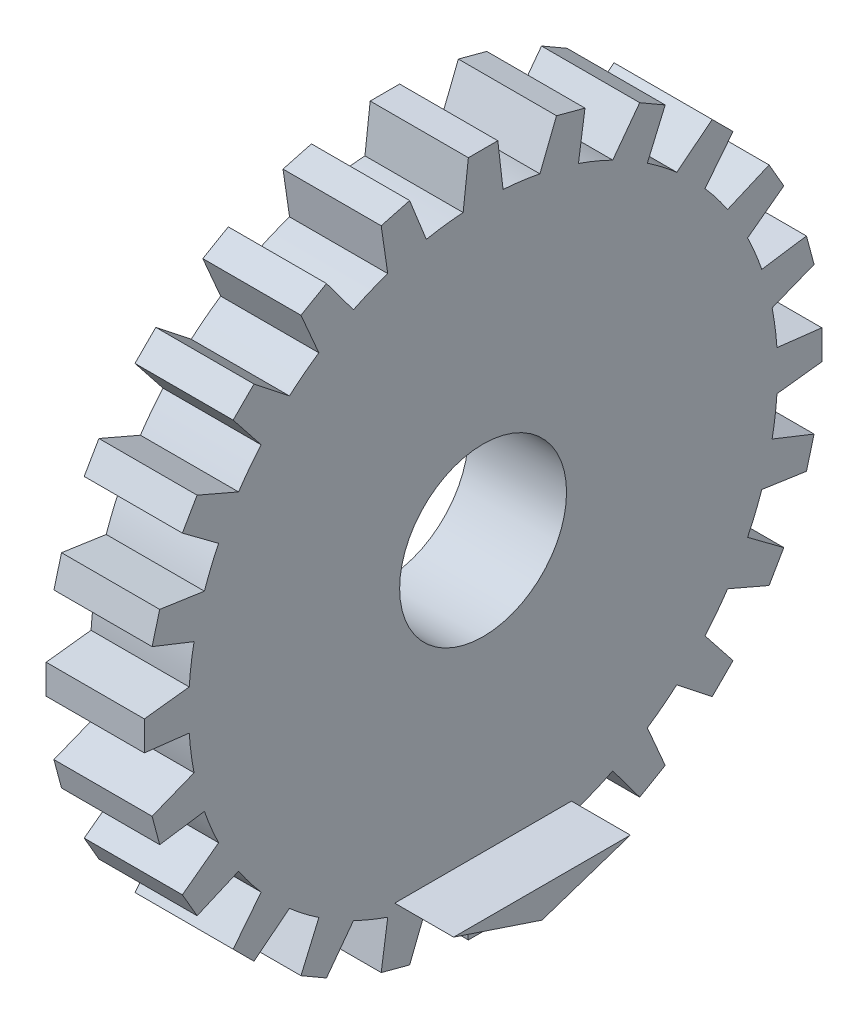
from build123d import *

# Parameters (mm, degrees)
SKETCH2_R           = 5
BOSS_EXTRUDE1_DEPTH = 100
SKETCH8_R           = 5
BOSS_EXTRUDE3_DEPTH = 10
SKETCH9_R           = 5
BOSS_EXTRUDE4_DEPTH = 100
BOSS_EXTRUDE5_START = 100
SKETCH4_R           = 5
BOSS_EXTRUDE5_DEPTH = 100
SKETCH17_R          = 8.5
CUT_EXTRUDE1_DEPTH  = 305
BOSS_EXTRUDE8_DEPTH = 6


with BuildPart() as part:
    # Sketch2 → Boss-Extrude1 (new body)
    with BuildSketch(Plane(origin=(0, 0, 0), x_dir=(0, 0, -1), z_dir=(1, 0, 0))):
        Circle(SKETCH2_R)
    extrude(amount=BOSS_EXTRUDE1_DEPTH)

    # Sketch8 → Boss-Extrude3 (add)
    with BuildSketch(Plane.ZY):
        with BuildLine():
            ThreePointArc((5.782716145, 29.437394484), (3.915785767, 29.743345841), (2.03328346, 29.931016661))
            Line((2.03328346, 29.931016661), (1.5, 34.5))
            Line((1.5, 34.5), (-1.5, 34.5))
            Line((-1.5, 34.5), (-2.03328346, 29.931016661))
            ThreePointArc((-2.03328346, 29.931016661), (-3.915785767, 29.743345841), (-5.782716145, 29.437394484))
            Line((-5.782716145, 29.437394484), (-7.480368317, 33.712669575))
            Line((-7.480368317, 33.712669575), (-10.378145795, 32.936212439))
            Line((-10.378145795, 32.936212439), (-9.710718158, 28.384889516))
            ThreePointArc((-9.710718158, 28.384889516), (-11.480502971, 27.716385975), (-13.204633201, 26.93766252))
            Line((-13.204633201, 26.93766252), (-15.950961894, 30.627876431))
            Line((-15.950961894, 30.627876431), (-18.549038106, 29.127876431))
            Line((-18.549038106, 29.127876431), (-16.72638346, 24.904379059))
            ThreePointArc((-16.72638346, 24.904379059), (-18.26284287, 23.800600209), (-19.726676326, 22.602173372))
            Line((-19.726676326, 22.602173372), (-23.334523779, 25.455844123))
            Line((-23.334523779, 25.455844123), (-25.455844123, 23.334523779))
            Line((-25.455844123, 23.334523779), (-22.602173372, 19.726676326))
            ThreePointArc((-22.602173372, 19.726676326), (-23.800600209, 18.26284287), (-24.904379059, 16.72638346))
            Line((-24.904379059, 16.72638346), (-29.127876431, 18.549038106))
            Line((-29.127876431, 18.549038106), (-30.627876431, 15.950961894))
            Line((-30.627876431, 15.950961894), (-26.93766252, 13.204633201))
            ThreePointArc((-26.93766252, 13.204633201), (-27.716385975, 11.480502971), (-28.384889516, 9.710718158))
            Line((-28.384889516, 9.710718158), (-32.936212439, 10.378145795))
            Line((-32.936212439, 10.378145795), (-33.712669575, 7.480368317))
            Line((-33.712669575, 7.480368317), (-29.437394484, 5.782716145))
            ThreePointArc((-29.437394484, 5.782716145), (-29.743345841, 3.915785767), (-29.931016661, 2.03328346))
            Line((-29.931016661, 2.03328346), (-34.5, 1.5))
            Line((-34.5, 1.5), (-34.5, -1.5))
            Line((-34.5, -1.5), (-29.931016661, -2.03328346))
            ThreePointArc((-29.931016661, -2.03328346), (-29.743345841, -3.915785767), (-29.437394484, -5.782716145))
            Line((-29.437394484, -5.782716145), (-33.712669575, -7.480368317))
            Line((-33.712669575, -7.480368317), (-32.936212439, -10.378145795))
            Line((-32.936212439, -10.378145795), (-28.384889516, -9.710718158))
            ThreePointArc((-28.384889516, -9.710718158), (-27.716385975, -11.480502971), (-26.93766252, -13.204633201))
            Line((-26.93766252, -13.204633201), (-30.627876431, -15.950961894))
            Line((-30.627876431, -15.950961894), (-29.127876431, -18.549038106))
            Line((-29.127876431, -18.549038106), (-24.904379059, -16.72638346))
            ThreePointArc((-24.904379059, -16.72638346), (-23.800600209, -18.26284287), (-22.602173372, -19.726676326))
            Line((-22.602173372, -19.726676326), (-25.455844123, -23.334523779))
            Line((-25.455844123, -23.334523779), (-23.334523779, -25.455844123))
            Line((-23.334523779, -25.455844123), (-19.726676326, -22.602173372))
            ThreePointArc((-19.726676326, -22.602173372), (-18.26284287, -23.800600209), (-16.72638346, -24.904379059))
            Line((-16.72638346, -24.904379059), (-18.549038106, -29.127876431))
            Line((-18.549038106, -29.127876431), (-15.950961894, -30.627876431))
            Line((-15.950961894, -30.627876431), (-13.204633201, -26.93766252))
            ThreePointArc((-13.204633201, -26.93766252), (-11.480502971, -27.716385975), (-9.710718158, -28.384889516))
            Line((-9.710718158, -28.384889516), (-10.378145795, -32.936212439))
            Line((-10.378145795, -32.936212439), (-7.480368317, -33.712669575))
            Line((-7.480368317, -33.712669575), (-5.782716145, -29.437394484))
            ThreePointArc((-5.782716145, -29.437394484), (-3.915785767, -29.743345841), (-2.03328346, -29.931016661))
            Line((-2.03328346, -29.931016661), (-1.5, -34.5))
            Line((-1.5, -34.5), (1.5, -34.5))
            Line((1.5, -34.5), (2.03328346, -29.931016661))
            ThreePointArc((2.03328346, -29.931016661), (3.915785767, -29.743345841), (5.782716145, -29.437394484))
            Line((5.782716145, -29.437394484), (7.480368317, -33.712669575))
            Line((7.480368317, -33.712669575), (10.378145795, -32.936212439))
            Line((10.378145795, -32.936212439), (9.710718158, -28.384889516))
            ThreePointArc((9.710718158, -28.384889516), (11.480502971, -27.716385975), (13.204633201, -26.93766252))
            Line((13.204633201, -26.93766252), (15.950961894, -30.627876431))
            Line((15.950961894, -30.627876431), (18.549038106, -29.127876431))
            Line((18.549038106, -29.127876431), (16.72638346, -24.904379059))
            ThreePointArc((16.72638346, -24.904379059), (18.26284287, -23.800600209), (19.726676326, -22.602173372))
            Line((19.726676326, -22.602173372), (23.334523779, -25.455844123))
            Line((23.334523779, -25.455844123), (25.455844123, -23.334523779))
            Line((25.455844123, -23.334523779), (22.602173372, -19.726676326))
            ThreePointArc((22.602173372, -19.726676326), (23.800600209, -18.26284287), (24.904379059, -16.72638346))
            Line((24.904379059, -16.72638346), (29.127876431, -18.549038106))
            Line((29.127876431, -18.549038106), (30.627876431, -15.950961894))
            Line((30.627876431, -15.950961894), (26.93766252, -13.204633201))
            ThreePointArc((26.93766252, -13.204633201), (27.716385975, -11.480502971), (28.384889516, -9.710718158))
            Line((28.384889516, -9.710718158), (32.936212439, -10.378145795))
            Line((32.936212439, -10.378145795), (33.712669575, -7.480368317))
            Line((33.712669575, -7.480368317), (29.437394484, -5.782716145))
            ThreePointArc((29.437394484, -5.782716145), (29.743345841, -3.915785767), (29.931016661, -2.03328346))
            Line((29.931016661, -2.03328346), (34.5, -1.5))
            Line((34.5, -1.5), (34.5, 1.5))
            Line((34.5, 1.5), (29.931016661, 2.03328346))
            ThreePointArc((29.931016661, 2.03328346), (29.743345841, 3.915785767), (29.437394484, 5.782716145))
            Line((29.437394484, 5.782716145), (33.712669575, 7.480368317))
            Line((33.712669575, 7.480368317), (32.936212439, 10.378145795))
            Line((32.936212439, 10.378145795), (28.384889516, 9.710718158))
            ThreePointArc((28.384889516, 9.710718158), (27.716385975, 11.480502971), (26.93766252, 13.204633201))
            Line((26.93766252, 13.204633201), (30.627876431, 15.950961894))
            Line((30.627876431, 15.950961894), (29.127876431, 18.549038106))
            Line((29.127876431, 18.549038106), (24.904379059, 16.72638346))
            ThreePointArc((24.904379059, 16.72638346), (23.800600209, 18.26284287), (22.602173372, 19.726676326))
            Line((22.602173372, 19.726676326), (25.455844123, 23.334523779))
            Line((25.455844123, 23.334523779), (23.334523779, 25.455844123))
            Line((23.334523779, 25.455844123), (19.726676326, 22.602173372))
            ThreePointArc((19.726676326, 22.602173372), (18.26284287, 23.800600209), (16.72638346, 24.904379059))
            Line((16.72638346, 24.904379059), (18.549038106, 29.127876431))
            Line((18.549038106, 29.127876431), (15.950961894, 30.627876431))
            Line((15.950961894, 30.627876431), (13.204633201, 26.93766252))
            ThreePointArc((13.204633201, 26.93766252), (11.480502971, 27.716385975), (9.710718158, 28.384889516))
            Line((9.710718158, 28.384889516), (10.378145795, 32.936212439))
            Line((10.378145795, 32.936212439), (7.480368317, 33.712669575))
            Line((7.480368317, 33.712669575), (5.782716145, 29.437394484))
        make_face()
        Circle(SKETCH8_R, mode=Mode.SUBTRACT)
    extrude(amount=-BOSS_EXTRUDE3_DEPTH)

    # Sketch9 → Boss-Extrude4 (add)
    with BuildSketch(Plane(origin=(100, 0, 0), x_dir=(0, 0, -1), z_dir=(1, 0, 0))):
        Circle(SKETCH9_R)
    extrude(amount=BOSS_EXTRUDE4_DEPTH)

    # Sketch4 → Boss-Extrude5 (add)
    with BuildSketch(Plane.ZY.offset(BOSS_EXTRUDE5_START)):
        Circle(SKETCH4_R)
    extrude(amount=-BOSS_EXTRUDE5_DEPTH)

    # Sketch17 → Cut-Extrude1 (cut)
    with BuildSketch(Plane(origin=(200, 0, 0), x_dir=(0, 0, -1), z_dir=(1, 0, 0))):
        Circle(SKETCH17_R)
    extrude(amount=-CUT_EXTRUDE1_DEPTH, mode=Mode.SUBTRACT)

    # Sketch18 → Boss-Extrude8 (add)
    with BuildSketch(Plane(origin=(10, 0, 0), x_dir=(0, 0, -1), z_dir=(1, 0, 0))):
        Polygon((0, -30.5), (9, -27.5), (-9, -27.5), align=None)
    extrude(amount=BOSS_EXTRUDE8_DEPTH)


solid = part.part
